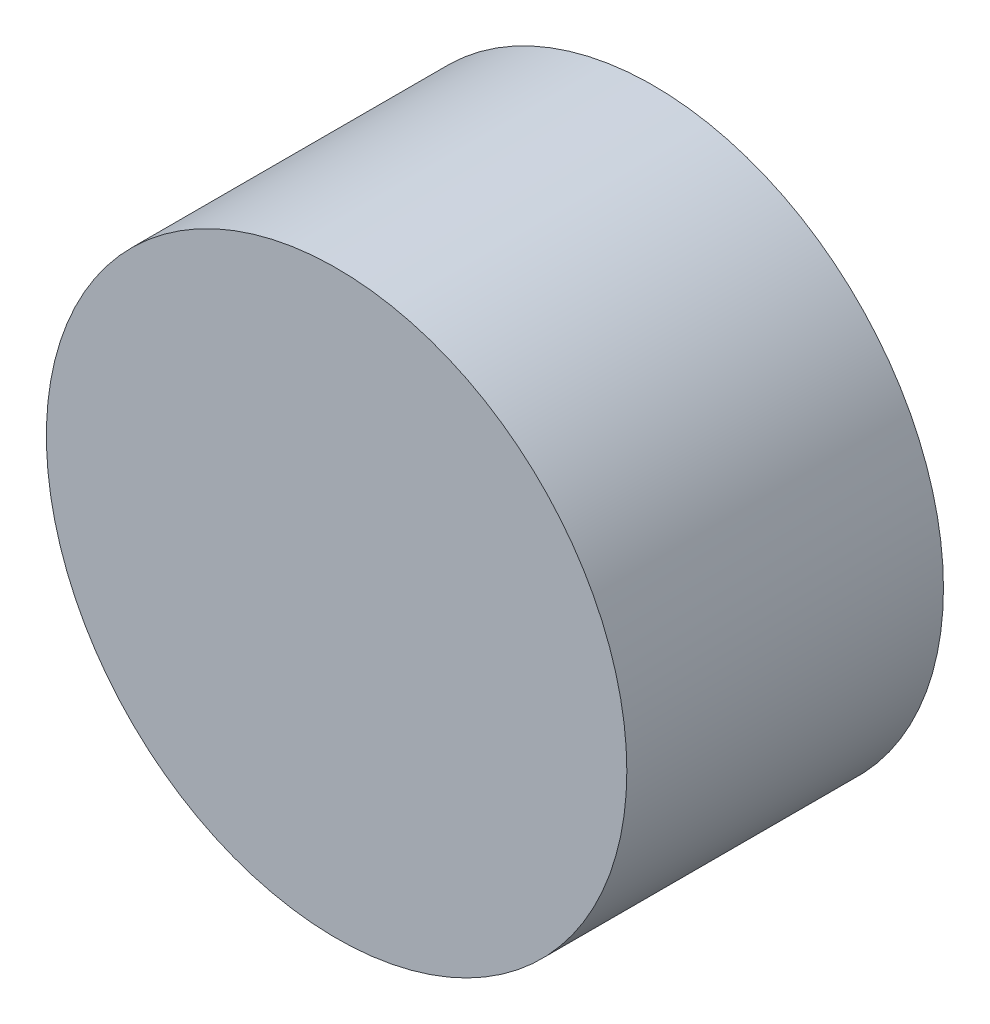
from build123d import *

# Parameters (mm, degrees)
SKETCH1_R           = 2.75
BOSS_EXTRUDE1_DEPTH = 3


with BuildPart() as part:
    # Sketch1 → Boss-Extrude1 (new body)
    with BuildSketch(Plane.XY):
        Circle(SKETCH1_R)
    extrude(amount=BOSS_EXTRUDE1_DEPTH)


solid = part.part
